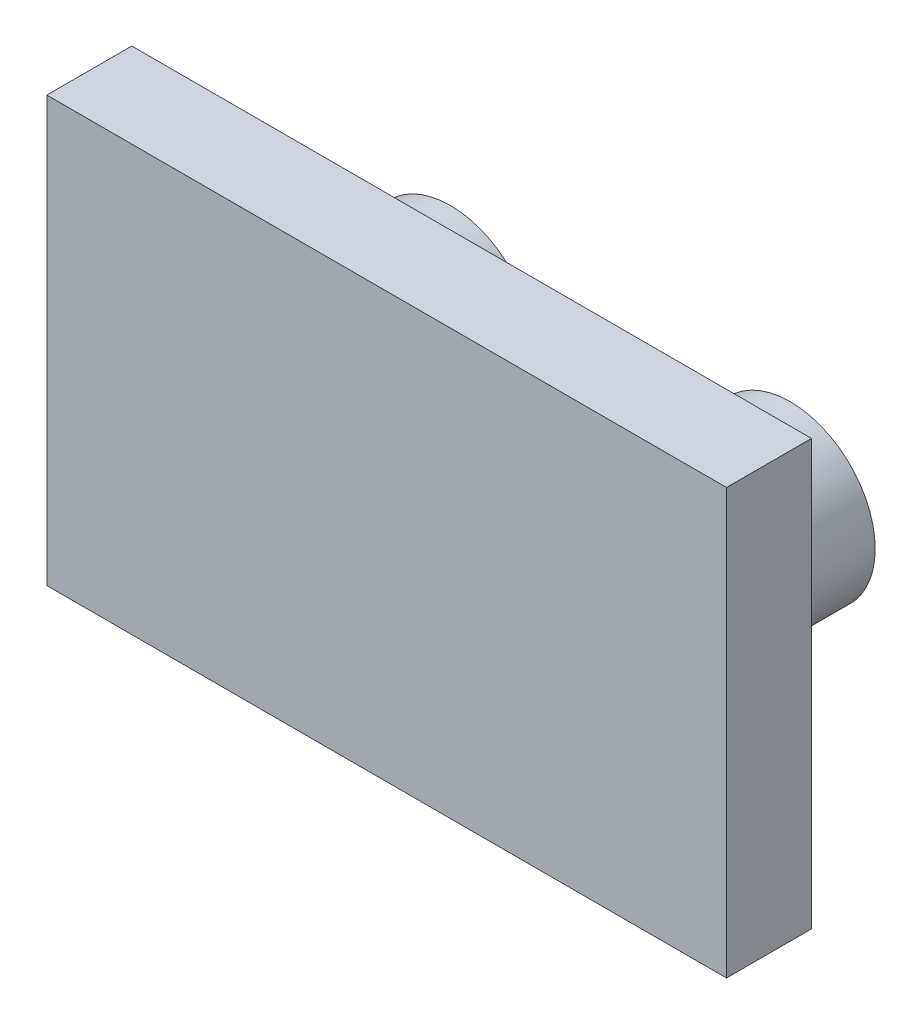
from build123d import *

# Parameters (mm, degrees)
SKETCH_1_W      = 160
SKETCH_1_H      = 100
EXTRUDE_4_DEPTH = 20
SKETCH_3_R      = 20
EXTRUDE_5_DEPTH = 35


with BuildPart() as part:
    # 草图1 → 凸台-拉伸4 (new body)
    with BuildSketch(Plane.XY):
        with Locations((-86.209434593, 50.003007896)):
            Rectangle(SKETCH_1_W, SKETCH_1_H)
    extrude(amount=-EXTRUDE_4_DEPTH)

    # 草图3 → 凸台-拉伸5 (add)
    with BuildSketch(Plane(origin=(0, 0, -20), x_dir=(-1, 0, 0), z_dir=(0, 0, -1))):
        with Locations(Location((46.209434593, 50.003007896, 0), (0, 0, 180))):
            Circle(SKETCH_3_R)
        with Locations(Location((126.209434593, 50.003007896, 0), (0, 0, 180))):
            Circle(SKETCH_3_R)
    extrude(amount=EXTRUDE_5_DEPTH)


solid = part.part
